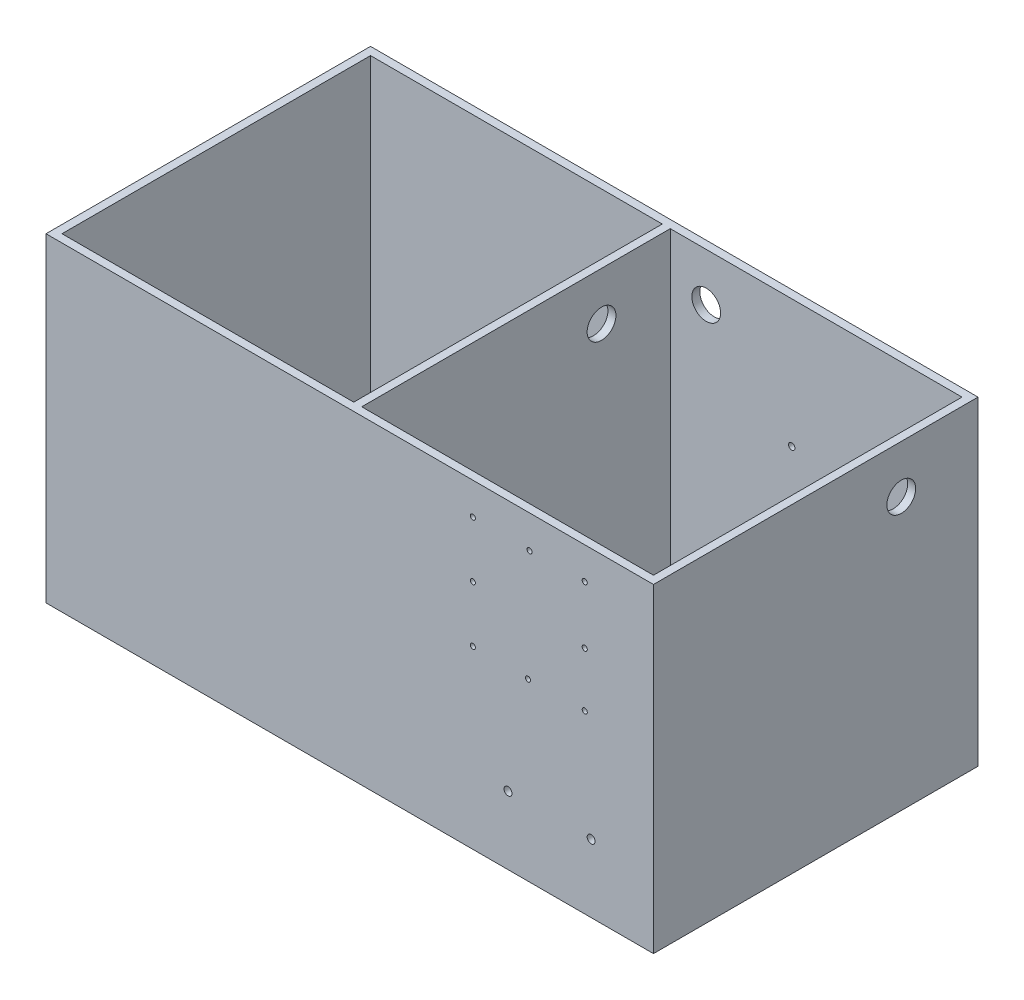
from build123d import *

# Parameters (mm, degrees)
EXTRUDE_1_DEPTH     = 200
CUT_EXTRUDE_1_DEPTH = 195
CUT_EXTRUDE_4_REACH = 443.251
SKETCH_9_R          = 9
CUT_EXTRUDE_5_REACH = 344.504
SKETCH_11_R         = 1.6
CUT_EXTRUDE_6_REACH = 344.504
SKETCH_12_R         = 1.6
CUT_EXTRUDE_7_REACH = 344.504
SKETCH_13_R         = 2.5
SKETCH_14_W         = 5
SKETCH_14_H         = 193
EXTRUDE_2_DEPTH     = 195
CUT_EXTRUDE_8_REACH = 344.504
SKETCH_15_R         = 2
SKETCH_15_R_2       = 9
CUT_EXTRUDE_9_REACH = 297.565
SKETCH_16_R         = 9


with BuildPart() as part:
    # 草图1 → 凸台-拉伸1 (new body)
    with BuildSketch(Plane(origin=(0, 0, 0), x_dir=(1, 0, 0), z_dir=(0, 1, 0))):
        Polygon((-190, 78.5), (-190, 101.5), (-167, 101.5), (167, 101.5), (190, 101.5), (190, 78.5), (190, -78.5), (190, -101.5), (167, -101.5), (-167, -101.5), (-190, -101.5), (-190, -78.5), align=None)
    extrude(amount=EXTRUDE_1_DEPTH)

    # 草图3 → 切除-拉伸1 (cut)
    with BuildSketch(Plane(origin=(0, 200, 0), x_dir=(1, 0, 0), z_dir=(0, 1, 0))):
        Polygon((-167, 96.5), (167, 96.5), (185, 96.5), (185, 78.5), (185, -78.5), (185, -96.5), (167, -96.5), (-167, -96.5), (-185, -96.5), (-185, -78.5), (-185, 78.5), (-185, 96.5), align=None)
    extrude(amount=-CUT_EXTRUDE_1_DEPTH, mode=Mode.SUBTRACT)

    # 草图9 → 切除-拉伸4 (cut, up to next)
    with BuildSketch(Plane(origin=(190, 0, 0), x_dir=(0, 0, -1), z_dir=(1, 0, 0)), mode=Mode.PRIVATE) as cut_extrude_4_sk1:
        with Locations((53.5, 170)):
            Circle(SKETCH_9_R)
    cut_extrude_4_tool1 = extrude(cut_extrude_4_sk1.sketch, amount=-CUT_EXTRUDE_4_REACH, mode=Mode.PRIVATE) & part.part
    add(cut_extrude_4_tool1.solids().sort_by_distance((190, 170, -53.5))[0], mode=Mode.SUBTRACT)

    # 草图11 → 切除-拉伸5 (cut, up to next)
    with BuildSketch(Plane.XY.offset(101.5), mode=Mode.PRIVATE) as cut_extrude_5_sk1:
        with Locations((77, 180)):
            Circle(SKETCH_11_R)
    cut_extrude_5_tool1 = extrude(cut_extrude_5_sk1.sketch, amount=-CUT_EXTRUDE_5_REACH, mode=Mode.PRIVATE) & part.part
    # 草图11 → 切除-拉伸5 (cut, up to next)
    with BuildSketch(Plane.XY.offset(101.5), mode=Mode.PRIVATE) as cut_extrude_5_sk2:
        with Locations((147, 180)):
            Circle(SKETCH_11_R)
    cut_extrude_5_tool2 = extrude(cut_extrude_5_sk2.sketch, amount=-CUT_EXTRUDE_5_REACH, mode=Mode.PRIVATE) & part.part
    # 草图11 → 切除-拉伸5 (cut, up to next)
    with BuildSketch(Plane.XY.offset(101.5), mode=Mode.PRIVATE) as cut_extrude_5_sk3:
        with Locations((77, 110)):
            Circle(SKETCH_11_R)
    cut_extrude_5_tool3 = extrude(cut_extrude_5_sk3.sketch, amount=-CUT_EXTRUDE_5_REACH, mode=Mode.PRIVATE) & part.part
    # 草图11 → 切除-拉伸5 (cut, up to next)
    with BuildSketch(Plane.XY.offset(101.5), mode=Mode.PRIVATE) as cut_extrude_5_sk4:
        with Locations((147, 110)):
            Circle(SKETCH_11_R)
    cut_extrude_5_tool4 = extrude(cut_extrude_5_sk4.sketch, amount=-CUT_EXTRUDE_5_REACH, mode=Mode.PRIVATE) & part.part
    add(cut_extrude_5_tool1.solids().sort_by_distance((77, 180, 101.5))[0], mode=Mode.SUBTRACT)
    add(cut_extrude_5_tool2.solids().sort_by_distance((147, 180, 101.5))[0], mode=Mode.SUBTRACT)
    add(cut_extrude_5_tool3.solids().sort_by_distance((77, 110, 101.5))[0], mode=Mode.SUBTRACT)
    add(cut_extrude_5_tool4.solids().sort_by_distance((147, 110, 101.5))[0], mode=Mode.SUBTRACT)

    # 草图12 → 切除-拉伸6 (cut, up to next)
    with BuildSketch(Plane.XY.offset(101.5), mode=Mode.PRIVATE) as cut_extrude_6_sk1:
        with Locations((77, 145)):
            Circle(SKETCH_12_R)
    cut_extrude_6_tool1 = extrude(cut_extrude_6_sk1.sketch, amount=-CUT_EXTRUDE_6_REACH, mode=Mode.PRIVATE) & part.part
    # 草图12 → 切除-拉伸6 (cut, up to next)
    with BuildSketch(Plane.XY.offset(101.5), mode=Mode.PRIVATE) as cut_extrude_6_sk2:
        with Locations((112.496378105, 179.496480131)):
            Circle(SKETCH_12_R)
    cut_extrude_6_tool2 = extrude(cut_extrude_6_sk2.sketch, amount=-CUT_EXTRUDE_6_REACH, mode=Mode.PRIVATE) & part.part
    # 草图12 → 切除-拉伸6 (cut, up to next)
    with BuildSketch(Plane.XY.offset(101.5), mode=Mode.PRIVATE) as cut_extrude_6_sk3:
        with Locations((146.992858236, 144.000102025)):
            Circle(SKETCH_12_R)
    cut_extrude_6_tool3 = extrude(cut_extrude_6_sk3.sketch, amount=-CUT_EXTRUDE_6_REACH, mode=Mode.PRIVATE) & part.part
    # 草图12 → 切除-拉伸6 (cut, up to next)
    with BuildSketch(Plane.XY.offset(101.5), mode=Mode.PRIVATE) as cut_extrude_6_sk4:
        with Locations((111.496480131, 109.503621895)):
            Circle(SKETCH_12_R)
    cut_extrude_6_tool4 = extrude(cut_extrude_6_sk4.sketch, amount=-CUT_EXTRUDE_6_REACH, mode=Mode.PRIVATE) & part.part
    add(cut_extrude_6_tool1.solids().sort_by_distance((77, 145, 101.5))[0], mode=Mode.SUBTRACT)
    add(cut_extrude_6_tool2.solids().sort_by_distance((112.496378, 179.49648, 101.5))[0], mode=Mode.SUBTRACT)
    add(cut_extrude_6_tool3.solids().sort_by_distance((146.992858, 144.000102, 101.5))[0], mode=Mode.SUBTRACT)
    add(cut_extrude_6_tool4.solids().sort_by_distance((111.49648, 109.503622, 101.5))[0], mode=Mode.SUBTRACT)

    # 草图13 → 切除-拉伸7 (cut, up to next)
    with BuildSketch(Plane.XY.offset(101.5), mode=Mode.PRIVATE) as cut_extrude_7_sk1:
        with Locations((99, 42.5)):
            Circle(SKETCH_13_R)
    cut_extrude_7_tool1 = extrude(cut_extrude_7_sk1.sketch, amount=-CUT_EXTRUDE_7_REACH, mode=Mode.PRIVATE) & part.part
    # 草图13 → 切除-拉伸7 (cut, up to next)
    with BuildSketch(Plane.XY.offset(101.5), mode=Mode.PRIVATE) as cut_extrude_7_sk2:
        with Locations((151, 42.5)):
            Circle(SKETCH_13_R)
    cut_extrude_7_tool2 = extrude(cut_extrude_7_sk2.sketch, amount=-CUT_EXTRUDE_7_REACH, mode=Mode.PRIVATE) & part.part
    add(cut_extrude_7_tool1.solids().sort_by_distance((99, 42.5, 101.5))[0], mode=Mode.SUBTRACT)
    add(cut_extrude_7_tool2.solids().sort_by_distance((151, 42.5, 101.5))[0], mode=Mode.SUBTRACT)

    # 草图14 → 凸台-拉伸2 (add)
    with BuildSketch(Plane(origin=(0, 5, 0), x_dir=(1, 0, 0), z_dir=(0, 1, 0))):
        Rectangle(SKETCH_14_W, SKETCH_14_H)
    extrude(amount=EXTRUDE_2_DEPTH)

    # 草图15 → 切除-拉伸8 (cut, up to next)
    with BuildSketch(Plane(origin=(0, 0, -101.5), x_dir=(-1, 0, 0), z_dir=(0, 0, -1)), mode=Mode.PRIVATE) as cut_extrude_8_sk1:
        with Locations((-155, 120)):
            Circle(SKETCH_15_R)
    cut_extrude_8_tool1 = extrude(cut_extrude_8_sk1.sketch, amount=-CUT_EXTRUDE_8_REACH, mode=Mode.PRIVATE) & part.part
    # 草图15 → 切除-拉伸8 (cut, up to next)
    with BuildSketch(Plane(origin=(0, 0, -101.5), x_dir=(-1, 0, 0), z_dir=(0, 0, -1)), mode=Mode.PRIVATE) as cut_extrude_8_sk2:
        with Locations((-78.5, 120)):
            Circle(SKETCH_15_R)
    cut_extrude_8_tool2 = extrude(cut_extrude_8_sk2.sketch, amount=-CUT_EXTRUDE_8_REACH, mode=Mode.PRIVATE) & part.part
    # 草图15 → 切除-拉伸8 (cut, up to next)
    with BuildSketch(Plane(origin=(0, 0, -101.5), x_dir=(-1, 0, 0), z_dir=(0, 0, -1)), mode=Mode.PRIVATE) as cut_extrude_8_sk3:
        with Locations((-78.5, 65)):
            Circle(SKETCH_15_R)
    cut_extrude_8_tool3 = extrude(cut_extrude_8_sk3.sketch, amount=-CUT_EXTRUDE_8_REACH, mode=Mode.PRIVATE) & part.part
    # 草图15 → 切除-拉伸8 (cut, up to next)
    with BuildSketch(Plane(origin=(0, 0, -101.5), x_dir=(-1, 0, 0), z_dir=(0, 0, -1)), mode=Mode.PRIVATE) as cut_extrude_8_sk4:
        with Locations((-155, 65)):
            Circle(SKETCH_15_R)
    cut_extrude_8_tool4 = extrude(cut_extrude_8_sk4.sketch, amount=-CUT_EXTRUDE_8_REACH, mode=Mode.PRIVATE) & part.part
    # 草图15 → 切除-拉伸8 (cut, up to next)
    with BuildSketch(Plane(origin=(0, 0, -101.5), x_dir=(-1, 0, 0), z_dir=(0, 0, -1)), mode=Mode.PRIVATE) as cut_extrude_8_sk5:
        with Locations((-25, 170)):
            Circle(SKETCH_15_R_2)
    cut_extrude_8_tool5 = extrude(cut_extrude_8_sk5.sketch, amount=-CUT_EXTRUDE_8_REACH, mode=Mode.PRIVATE) & part.part
    add(cut_extrude_8_tool1.solids().sort_by_distance((155, 120, -101.5))[0], mode=Mode.SUBTRACT)
    add(cut_extrude_8_tool2.solids().sort_by_distance((78.5, 120, -101.5))[0], mode=Mode.SUBTRACT)
    add(cut_extrude_8_tool3.solids().sort_by_distance((78.5, 65, -101.5))[0], mode=Mode.SUBTRACT)
    add(cut_extrude_8_tool4.solids().sort_by_distance((155, 65, -101.5))[0], mode=Mode.SUBTRACT)
    add(cut_extrude_8_tool5.solids().sort_by_distance((25, 170, -101.5))[0], mode=Mode.SUBTRACT)

    # 草图16 → 切除-拉伸9 (cut, up to next)
    with BuildSketch(Plane(origin=(2.5, 0, 0), x_dir=(0, 0, -1), z_dir=(1, 0, 0)), mode=Mode.PRIVATE) as cut_extrude_9_sk1:
        with Locations((53.5, 170)):
            Circle(SKETCH_16_R)
    cut_extrude_9_tool1 = extrude(cut_extrude_9_sk1.sketch, amount=-CUT_EXTRUDE_9_REACH, mode=Mode.PRIVATE) & part.part
    add(cut_extrude_9_tool1.solids().sort_by_distance((2.5, 170, -53.5))[0], mode=Mode.SUBTRACT)


solid = part.part
